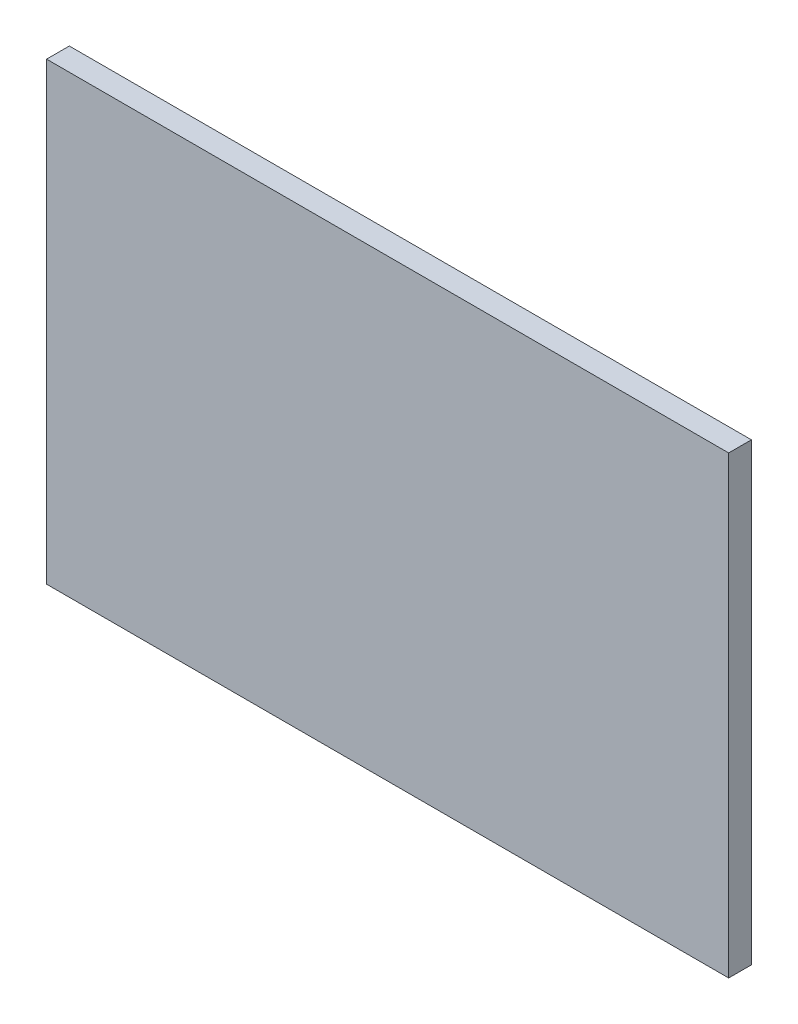
from build123d import *

# Parameters (mm, degrees)
ESQUISSE1_W        = 60
ESQUISSE1_H        = 40
BOSS_EXTRU_1_DEPTH = 2


with BuildPart() as part:
    # Esquisse1 → Boss.-Extru.1 (new body)
    with BuildSketch(Plane.XY):
        Rectangle(ESQUISSE1_W, ESQUISSE1_H)
    extrude(amount=BOSS_EXTRU_1_DEPTH)


solid = part.part
